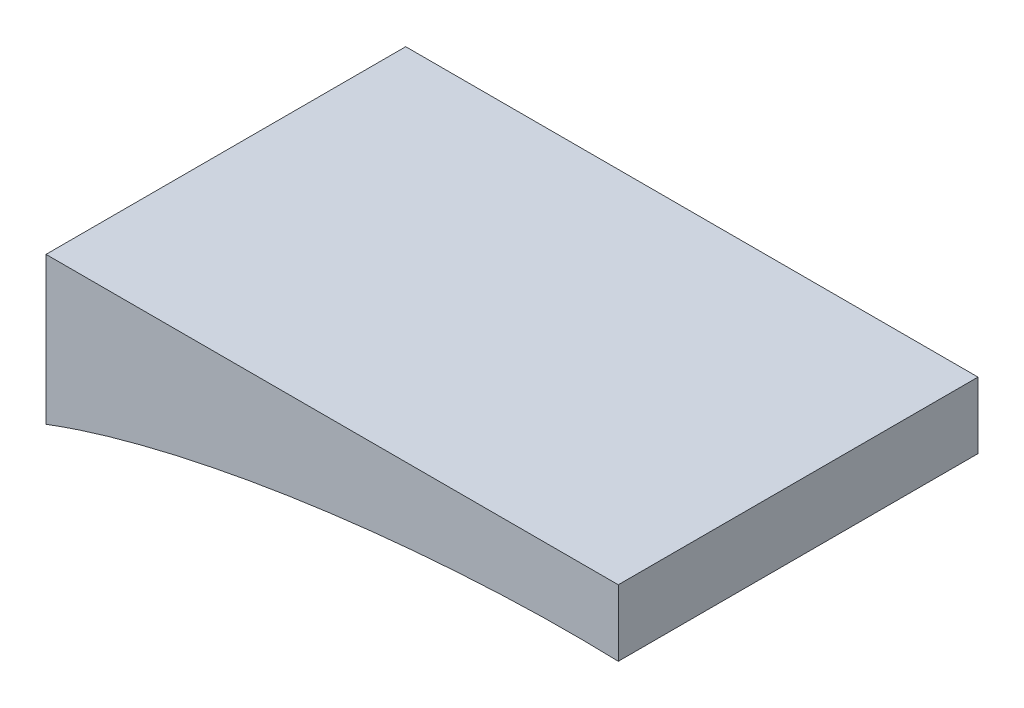
from build123d import *

# Parameters (mm, degrees)
BOSS_EXTRUDE1_DEPTH = 22


with BuildPart() as part:
    # Sketch3 → Boss-Extrude1 (new body)
    with BuildSketch(Plane.XY):
        with BuildLine():
            Line((7.5, 14.345427563), (7.5, 5.345427563))
            add(Edge.make_bspline(
                [(42.5, 10.290738099), (41.075352057, 10.33423544), (38.150630348, 10.360251139), (33.766527631, 10.18589116), (29.404540771, 9.859979537), (25.205664918, 9.396335122), (21.214632991, 8.814476405), (17.473244617, 8.129616096), (14.021102758, 7.355738731), (10.893158298, 6.510046925), (8.761065062, 5.813136295), (7.673577392, 5.410957689), (7.5, 5.345427563)],
                knots=[0.286215433, 0.286215433, 0.286215433, 0.286215433, 0.307088371, 0.329034071, 0.350454748, 0.371139118, 0.390890019, 0.409511982, 0.426831344, 0.442689348, 0.456949713, 0.459666394, 0.459666394, 0.459666394, 0.459666394], degree=3))
            Line((42.5, 10.290738099), (42.5, 14.345427563))
            Line((42.5, 14.345427563), (7.5, 14.345427563))
        make_face()
    extrude(amount=BOSS_EXTRUDE1_DEPTH)


solid = part.part
